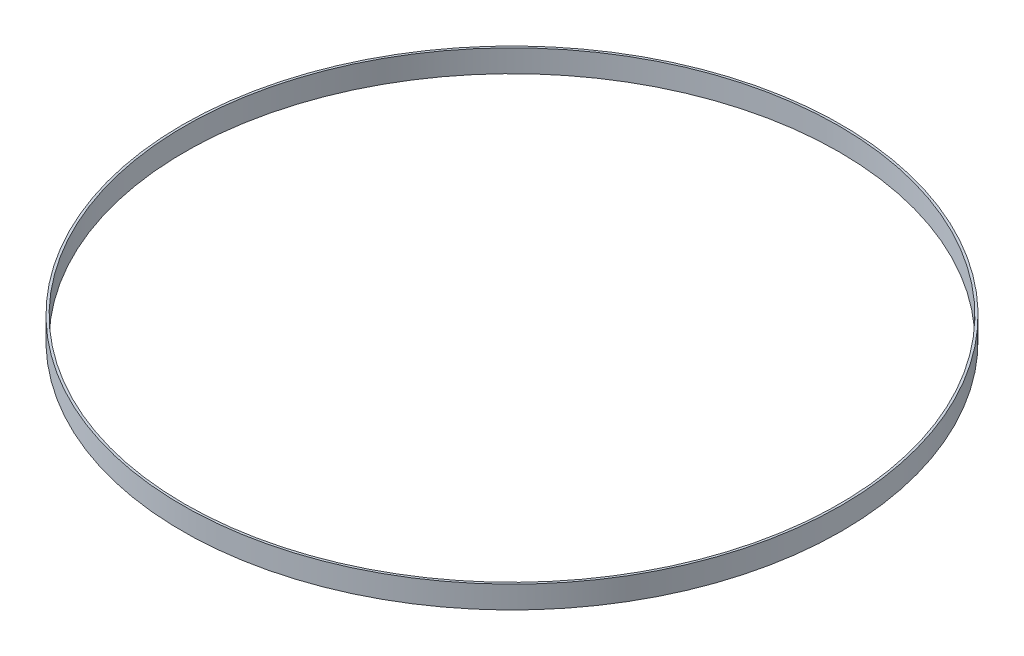
from build123d import *

# Parameters (mm, degrees)
SKETCH1_R           = 147.05
SKETCH1_R_2         = 146.05
EXTRUDE_THIN1_DEPTH = 10


with BuildPart() as part:
    # Sketch1 → Extrude-Thin1 (new body)
    with BuildSketch(Plane(origin=(0, 0, 0), x_dir=(1, 0, 0), z_dir=(0, 1, 0))):
        Circle(SKETCH1_R)
        Circle(SKETCH1_R_2, mode=Mode.SUBTRACT)
    extrude(amount=EXTRUDE_THIN1_DEPTH)


solid = part.part
